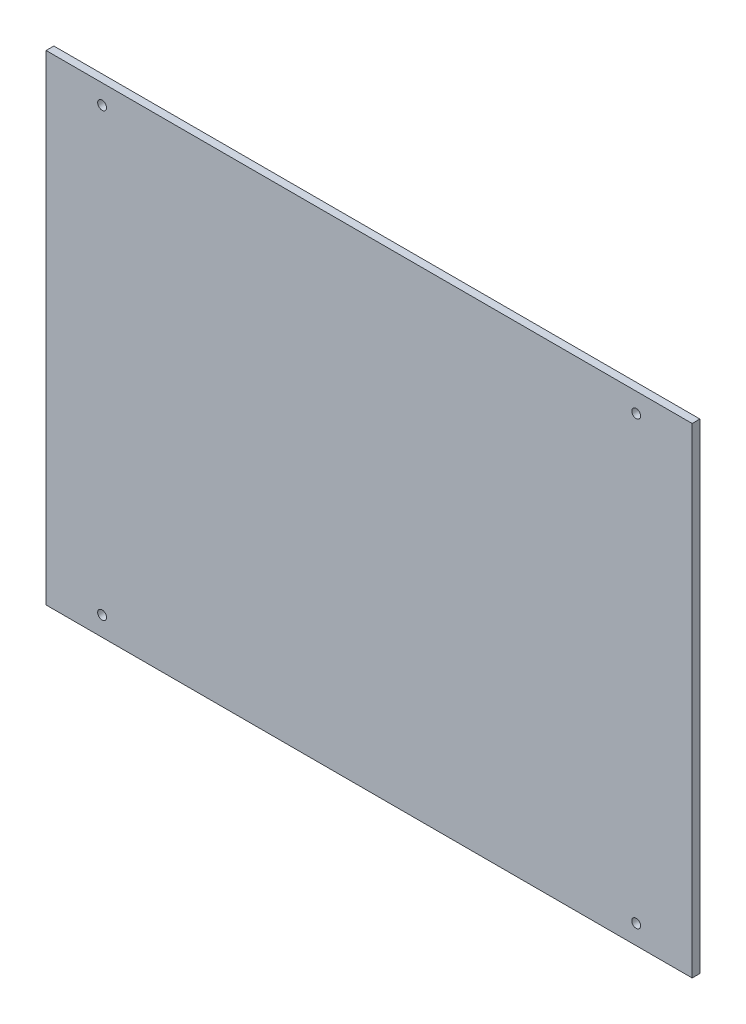
from build123d import *

# Parameters (mm, degrees)
ESQUISSE1_W        = 300
ESQUISSE1_H        = 223
ESQUISSE1_R        = 2.05
BOSS_EXTRU_1_DEPTH = 3.6


with BuildPart() as part:
    # Esquisse1 → Boss.-Extru.1 (new body)
    with BuildSketch(Plane.XY):
        Rectangle(ESQUISSE1_W, ESQUISSE1_H)
        with Locations((-124, 102.5)):
            Circle(ESQUISSE1_R, mode=Mode.SUBTRACT)
        with Locations(Location((-124, -102.5, 0), (0, 0, 180))):
            Circle(ESQUISSE1_R, mode=Mode.SUBTRACT)
        with Locations((124, -102.5)):
            Circle(ESQUISSE1_R, mode=Mode.SUBTRACT)
        with Locations(Location((124, 102.5, 0), (0, 0, 180))):
            Circle(ESQUISSE1_R, mode=Mode.SUBTRACT)
    extrude(amount=-BOSS_EXTRU_1_DEPTH)


solid = part.part
